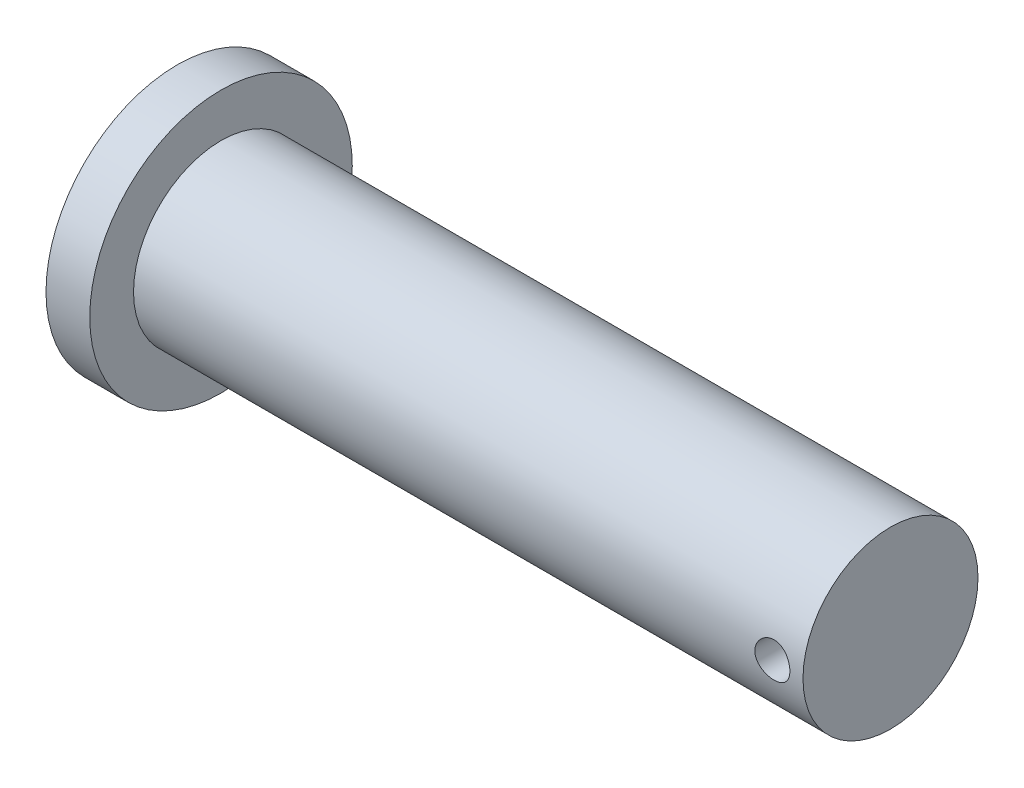
from build123d import *

# Parameters (mm, degrees)
SKETCH1_R               = 10
BOSS_EXTRUDE1_DEPTH     = 81.5
CUT_EXTRUDE1_DEPTH      = 25
CUT_EXTRUDE1_DEPTH_BACK = 19
SKETCH3_R               = 2
SKETCH4_R               = 15
BOSS_EXTRUDE2_DEPTH     = 5
SCALE1_SCALE            = 0.5


with BuildPart() as part:
    # Sketch1 → Boss-Extrude1 (new body)
    with BuildSketch(Plane(origin=(0, 0, 0), x_dir=(0, 0, -1), z_dir=(1, 0, 0))):
        Circle(SKETCH1_R)
    extrude(amount=BOSS_EXTRUDE1_DEPTH)

    # Sketch3 → Cut-Extrude1 (cut, two sides: drawn at the far end of the back side and taken through both)
    with BuildSketch(Plane.XY.offset(-CUT_EXTRUDE1_DEPTH_BACK)):
        with Locations((78, 0)):
            Circle(SKETCH3_R)
    extrude(amount=CUT_EXTRUDE1_DEPTH + CUT_EXTRUDE1_DEPTH_BACK, mode=Mode.SUBTRACT)

    # Sketch4 → Boss-Extrude2 (add)
    with BuildSketch(Plane.ZY):
        Circle(SKETCH4_R)
    extrude(amount=-BOSS_EXTRUDE2_DEPTH)


with BuildPart() as part_1:
    # Scale1: scaled about (0, 0, 0)
    add(part.part.scale(SCALE1_SCALE))


solid = part_1.part
